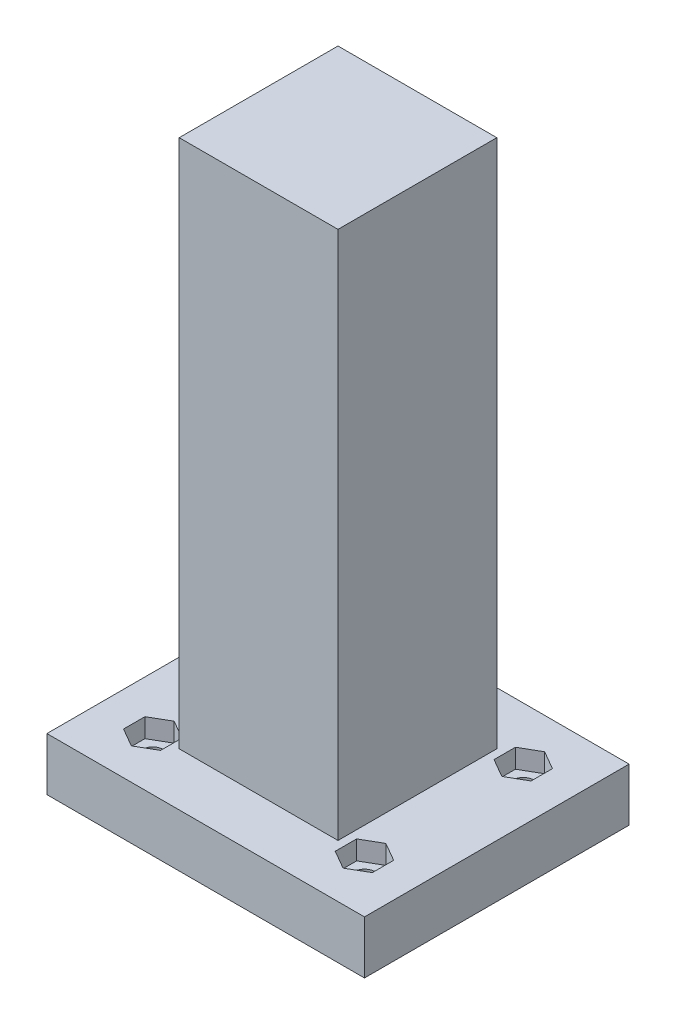
from build123d import *

# Parameters (mm, degrees)
SKETCH1_W           = 60
SKETCH1_H           = 50
BOSS_EXTRUDE1_DEPTH = 10
SKETCH2_R           = 2
CUT_EXTRUDE1_DEPTH  = 79.74007874
CUT_EXTRUDE2_DEPTH  = 3.6
SKETCH4_W           = 30
SKETCH4_H           = 30
BOSS_EXTRUDE2_DEPTH = 100
CUT_EXTRUDE5_START  = -30
SKETCH6_R           = 2
CUT_EXTRUDE5_DEPTH  = 30


with BuildPart() as part:
    # Sketch1 → Boss-Extrude1 (new body)
    with BuildSketch(Plane(origin=(0, 0, 0), x_dir=(1, 0, 0), z_dir=(0, 1, 0))):
        with Locations((30, -25)):
            Rectangle(SKETCH1_W, SKETCH1_H)
    extrude(amount=BOSS_EXTRUDE1_DEPTH)

    # Sketch2 → Cut-Extrude1 (cut, through all)
    with BuildSketch(Plane(origin=(0, 10, 0), x_dir=(1, 0, 0), z_dir=(0, 1, 0))):
        with Locations(Location((50, -10, 0), (0, 0, 270))):
            Circle(SKETCH2_R)
        with Locations(Location((10, -10, 0), (0, 0, 270))):
            Circle(SKETCH2_R)
        with Locations(Location((10, -40, 0), (0, 0, 270))):
            Circle(SKETCH2_R)
        with Locations(Location((50, -40, 0), (0, 0, 270))):
            Circle(SKETCH2_R)
        with Locations(Location((30, -25, 0), (0, 0, 270))):
            Circle(SKETCH2_R)
    extrude(amount=-CUT_EXTRUDE1_DEPTH, mode=Mode.SUBTRACT)

    # Sketch3 → Cut-Extrude2 (cut)
    with BuildSketch(Plane(origin=(0, 10, 0), x_dir=(1, 0, 0), z_dir=(0, 1, 0))):
        Polygon((10, -35.958548116), (6.5, -37.979274058), (6.5, -42.020725942), (10, -44.041451884), (13.5, -42.020725942), (13.5, -37.979274058), align=None)
        Polygon((50, -35.958548116), (46.5, -37.979274058), (46.5, -42.020725942), (50, -44.041451884), (53.5, -42.020725942), (53.5, -37.979274058), align=None)
        Polygon((50, -5.958548116), (46.5, -7.979274058), (46.5, -12.020725942), (50, -14.041451884), (53.5, -12.020725942), (53.5, -7.979274058), align=None)
        Polygon((10, -5.958548116), (6.5, -7.979274058), (6.5, -12.020725942), (10, -14.041451884), (13.5, -12.020725942), (13.5, -7.979274058), align=None)
    extrude(amount=-CUT_EXTRUDE2_DEPTH, mode=Mode.SUBTRACT)

    # Sketch4 → Boss-Extrude2 (add)
    with BuildSketch(Plane(origin=(0, 10, 0), x_dir=(1, 0, 0), z_dir=(0, 1, 0))):
        with Locations((30, -25)):
            Rectangle(SKETCH4_W, SKETCH4_H)
    extrude(amount=BOSS_EXTRUDE2_DEPTH)

    # Sketch6 → Cut-Extrude5 (cut)
    with BuildSketch(Plane.XZ.offset(-10).offset(CUT_EXTRUDE5_START)):
        with Locations(Location((30, 25, 0), (0, 0, 90))):
            Circle(SKETCH6_R)
    extrude(amount=CUT_EXTRUDE5_DEPTH, mode=Mode.SUBTRACT)


solid = part.part
